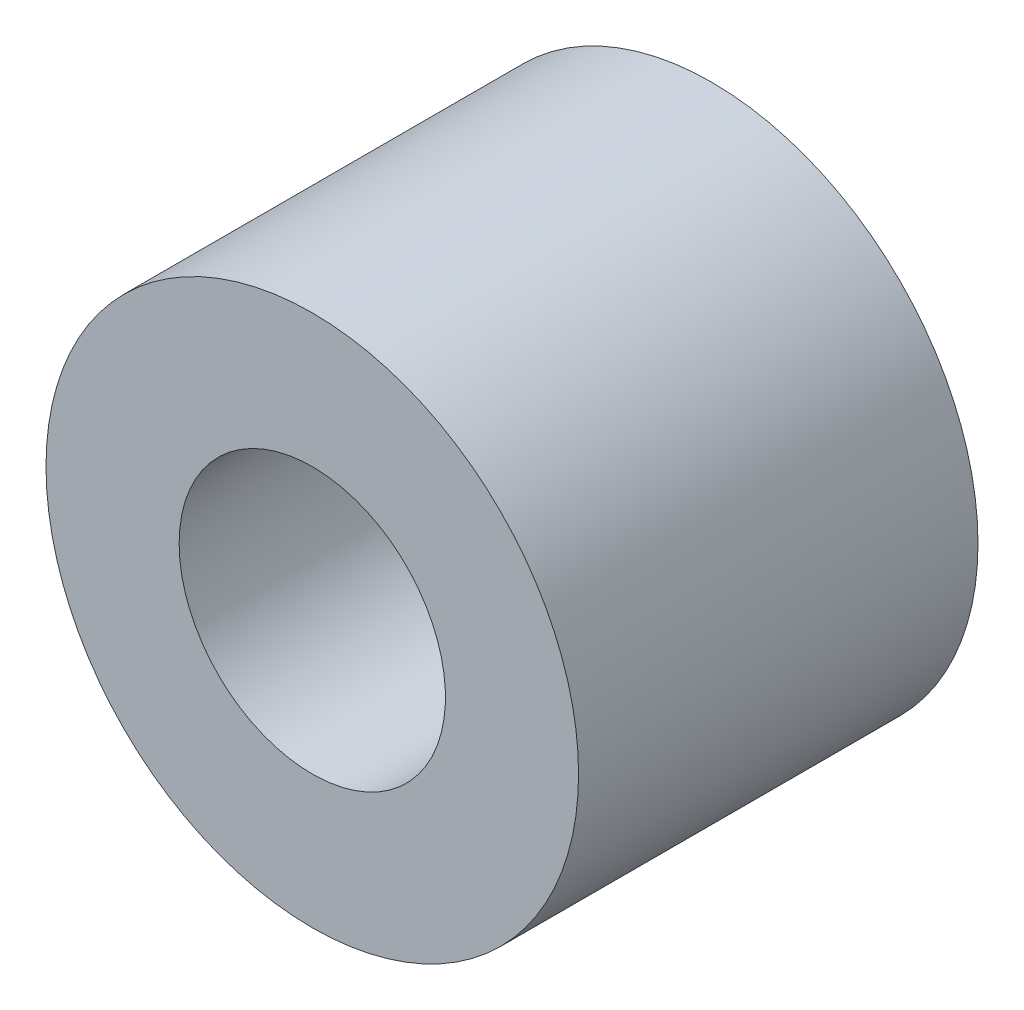
from build123d import *

# Parameters (mm, degrees)
SKETCH1_R           = 3.175
SKETCH1_R_2         = 1.5875
BOSS_EXTRUDE1_DEPTH = 4.7625
SCALE1_SCALE        = 0.75


with BuildPart() as part:
    # Sketch1 → Boss-Extrude1 (new body)
    with BuildSketch(Plane.XY):
        with Locations(Location((0, 0, 0), (0, 0, 180))):
            Circle(SKETCH1_R)
        with Locations(Location((0, 0, 0), (0, 0, 180))):
            Circle(SKETCH1_R_2, mode=Mode.SUBTRACT)
    extrude(amount=BOSS_EXTRUDE1_DEPTH)


with BuildPart() as part_1:
    # Scale1: scaled about (0, 0, 2.38125)
    add(part.part.scale(SCALE1_SCALE).moved(Location((0, 0, 0.5953125))))


solid = part_1.part
